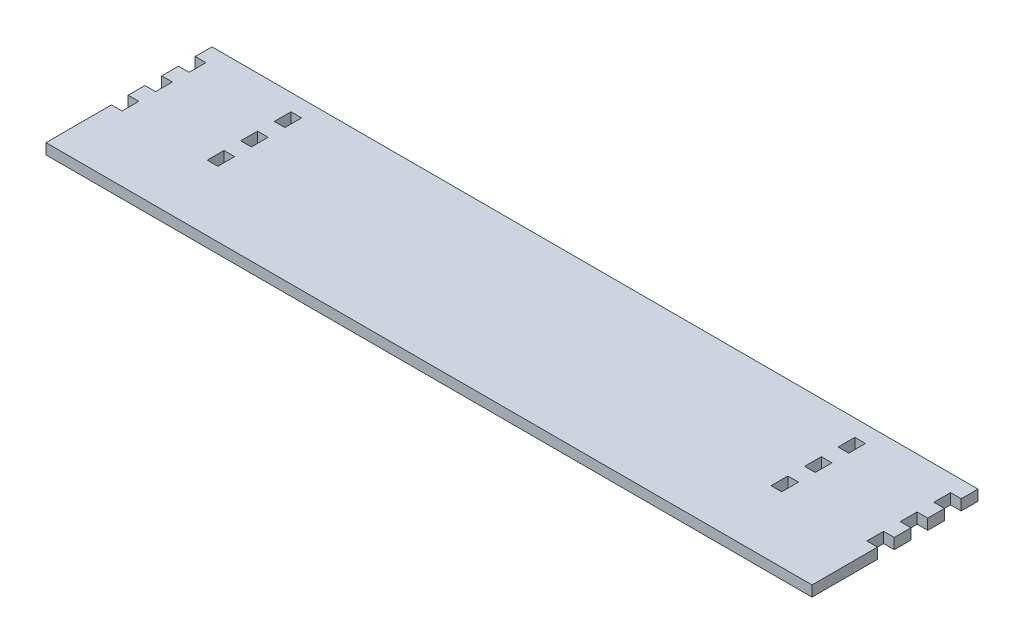
from build123d import *

# Parameters (mm, degrees)
SKETCH1_W           = 3.175
SKETCH1_H           = 5
BOSS_EXTRUDE1_DEPTH = 3.175


with BuildPart() as part:
    # Sketch1 → Boss-Extrude1 (new body)
    with BuildSketch(Plane(origin=(0, 0, 0), x_dir=(1, 0, 0), z_dir=(0, 1, 0))):
        Polygon((-228.6, -5), (-225.425, -5), (-225.425, -10), (-228.6, -10), (-228.6, -15), (-225.425, -15), (-225.425, -20), (-228.6, -20), (-228.6, -25), (-225.425, -25), (-225.425, -30), (-228.6, -30), (-228.6, -49.53), (-225.425, -49.53), (-19.177, -49.53), (0, -49.53), (0, -30), (-3.175, -30), (-3.175, -25), (0, -25), (0, -20), (-3.175, -20), (-3.175, -15), (0, -15), (0, -10), (-3.175, -10), (-3.175, -5), (0, -5), (0, 0), (-19.177, 0), (-225.425, 0), (-228.6, 0), align=None)
        with Locations((-198.4375, -7.5)):
            Rectangle(SKETCH1_W, SKETCH1_H, mode=Mode.SUBTRACT)
        with Locations((-198.4375, -17.5)):
            Rectangle(SKETCH1_W, SKETCH1_H, mode=Mode.SUBTRACT)
        with Locations((-198.4375, -27.5)):
            Rectangle(SKETCH1_W, SKETCH1_H, mode=Mode.SUBTRACT)
        with Locations((-30.1625, -27.5)):
            Rectangle(SKETCH1_W, SKETCH1_H, mode=Mode.SUBTRACT)
        with Locations((-30.1625, -17.5)):
            Rectangle(SKETCH1_W, SKETCH1_H, mode=Mode.SUBTRACT)
        with Locations((-30.1625, -7.5)):
            Rectangle(SKETCH1_W, SKETCH1_H, mode=Mode.SUBTRACT)
    extrude(amount=BOSS_EXTRUDE1_DEPTH)


solid = part.part
